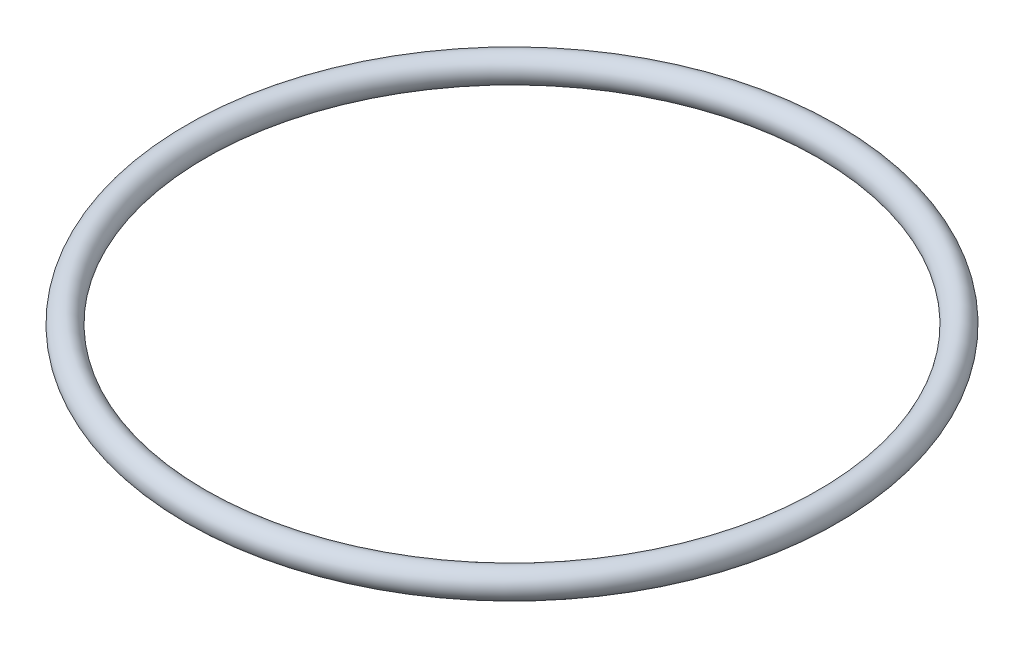
from build123d import *

# Parameters (mm, degrees)
SKETCH1_R = 1.5875


with BuildPart() as part:
    # Sketch1 → Revolve1 (revolve)
    with BuildSketch(Plane.XY, mode=Mode.PRIVATE) as revolve1_sk:
        with Locations((37.30625, 0)):
            Circle(SKETCH1_R)
    revolve(revolve1_sk.sketch.rotate(Axis((0, 0, 0), (0, 1, 0)), 90), axis=Axis((0, 0, 0), (0, 1, 0)))


solid = part.part
